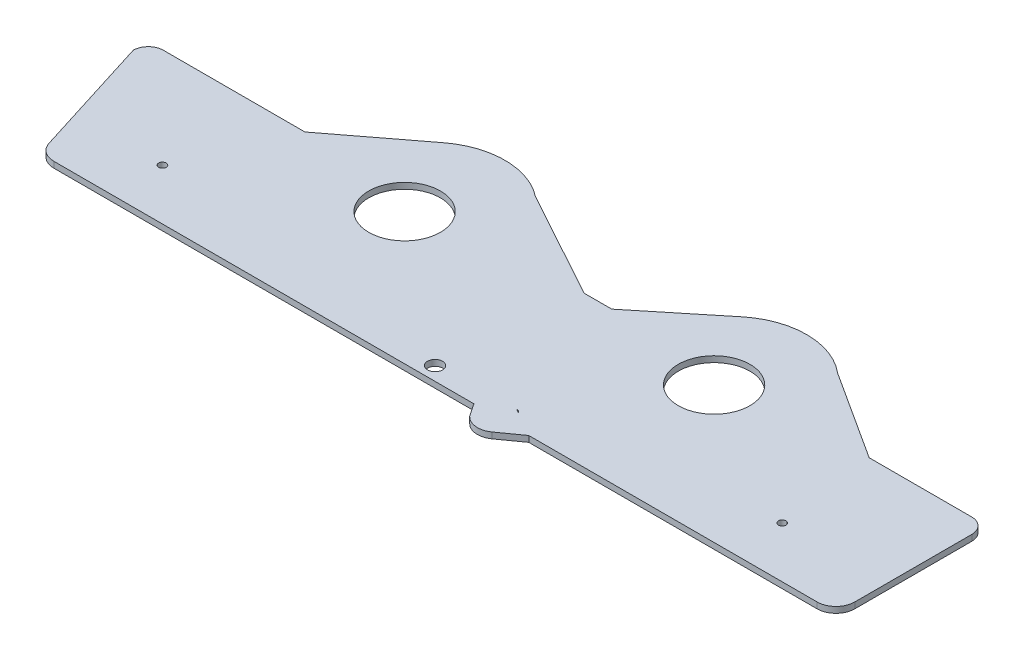
from build123d import *

# Parameters (mm, degrees)
SKETCH1_R                = 4.6
BOSS_EXTRUDE1_DEPTH      = 3.175
SKETCH2_W                = 597.466303312
SKETCH2_H                = 60.972543052
CUT_EXTRUDE1_DEPTH       = 70
FILLET1_R                = 10
FILLET2_R                = 10
SKETCH3_R                = 3.990837639
CUT_EXTRUDE2_DEPTH       = 10
SKETCH4_R                = 2
CUT_EXTRUDE3_DEPTH       = 470.13785887
SKETCH5_R                = 2
CUT_EXTRUDE4_DEPTH       = 10
SKETCH6_R                = 40
BOSS_EXTRUDE2_DEPTH      = 3.175
BOSS_EXTRUDE3_DEPTH      = 3.175
SKETCH9_R                = 40
BOSS_EXTRUDE4_DEPTH      = 3.175
BOSS_EXTRUDE6_DEPTH      = 3.175
SKETCH13_R               = 19
CUT_EXTRUDE5_DEPTH       = 10
SKETCH14_R               = 19
CUT_EXTRUDE6_DEPTH       = 10
BOSS_EXTRUDE7_DEPTH      = 10
BOSS_EXTRUDE7_DEPTH_BACK = 3.175
SKETCH16_W               = 39.380598922
SKETCH16_H               = 33.904845405
CUT_EXTRUDE7_DEPTH       = 10


with BuildPart() as part:
    # Sketch1 → Boss-Extrude1 (new body)
    with BuildSketch(Plane(origin=(0, 0, 0), x_dir=(1, 0, 0), z_dir=(0, 1, 0))):
        with BuildLine():
            ThreePointArc((8, 150), (2.343145751, 147.656854249), (0, 142))
            Line((0, 142), (42, 8))
            ThreePointArc((42, 8), (44.343145751, 2.343145751), (50, 0))
            Line((50, 0), (436.5, 0))
            ThreePointArc((436.5, 0), (442.156854249, 2.343145751), (444.5, 8))
            Line((444.5, 8), (444.5, 142))
            ThreePointArc((444.5, 142), (442.156854249, 147.656854249), (436.5, 150))
            Line((436.5, 150), (172.868406334, 150))
            ThreePointArc((172.868406334, 150), (172.5, 146.64039861), (172.131593666, 150))
            Line((172.131593666, 150), (8, 150))
        make_face()
        with Locations(Location((265.281257274, 74.563866981, 0), (0, 0, 270))):
            Circle(SKETCH1_R, mode=Mode.SUBTRACT)
    extrude(amount=BOSS_EXTRUDE1_DEPTH)

    # Sketch2 → Cut-Extrude1 (cut)
    with BuildSketch(Plane.XY):
        with Locations((220.1785332, 7.544358636)):
            Rectangle(SKETCH2_W, SKETCH2_H)
    extrude(amount=-CUT_EXTRUDE1_DEPTH, mode=Mode.SUBTRACT)

    # Fillet1
    fillet1_edges = [part.edges().sort_by_distance(p)[0] for p in [
        (22.567164179, 1.5875, -70),
    ]]
    fillet(fillet1_edges, radius=FILLET1_R)

    # Fillet2
    fillet2_edges = [part.edges().sort_by_distance(p)[0] for p in [
        (444.5, 1.5875, -70),
    ]]
    fillet(fillet2_edges, radius=FILLET2_R)

    # Sketch3 → Cut-Extrude2 (cut)
    with BuildSketch(Plane(origin=(0, 3.175, 0), x_dir=(1, 0, 0), z_dir=(0, 1, 0))):
        with Locations(Location((224.75, 77.255, 0), (0, 0, 270))):
            Circle(SKETCH3_R)
    extrude(amount=-CUT_EXTRUDE2_DEPTH, mode=Mode.SUBTRACT)

    # Sketch4 → Cut-Extrude3 (cut, through all)
    with BuildSketch(Plane(origin=(0, 3.175, 0), x_dir=(1, 0, 0), z_dir=(0, 1, 0))):
        with Locations(Location((60.5, 97, 0), (0, 0, 270))):
            Circle(SKETCH4_R)
    extrude(amount=-CUT_EXTRUDE3_DEPTH, mode=Mode.SUBTRACT)

    # Sketch5 → Cut-Extrude4 (cut)
    with BuildSketch(Plane(origin=(0, 3.175, 0), x_dir=(1, 0, 0), z_dir=(0, 1, 0))):
        with Locations(Location((389, 97, 0), (0, 0, 270))):
            Circle(SKETCH5_R)
    extrude(amount=-CUT_EXTRUDE4_DEPTH, mode=Mode.SUBTRACT)

    # Sketch6 → Boss-Extrude2 (add)
    with BuildSketch(Plane(origin=(0, 0, 0), x_dir=(1, 0, 0), z_dir=(0, 1, 0))):
        with Locations((149, 150.04039861)):
            Circle(SKETCH6_R)
    extrude(amount=BOSS_EXTRUDE2_DEPTH)

    # Sketch7 → Boss-Extrude3 (add)
    with BuildSketch(Plane(origin=(0, 0, 0), x_dir=(1, 0, 0), z_dir=(0, 1, 0))):
        Polygon((124.164543783, 181.396420591), (82.702881078, 149.750534228), (231.468946681, 149.750534228), (173.835456217, 181.396420591), align=None)
    extrude(amount=BOSS_EXTRUDE3_DEPTH)

    # Sketch9 → Boss-Extrude4 (add)
    with BuildSketch(Plane(origin=(0, 0, 0), x_dir=(1, 0, 0), z_dir=(0, 1, 0))):
        with BuildLine():
            ThreePointArc((269, 150), (272.870833001, 167.166341835), (283.734164599, 181.010281545))
            Line((283.734164599, 181.010281545), (245.673378314, 150))
            Line((245.673378314, 150), (269, 150))
        make_face()
        with Locations((309, 150)):
            Circle(SKETCH9_R)
    extrude(amount=BOSS_EXTRUDE4_DEPTH)

    # Sketch12 → Boss-Extrude6 (add)
    with BuildSketch(Plane(origin=(0, 0, 0), x_dir=(1, 0, 0), z_dir=(0, 1, 0))):
        Polygon((326.166341835, 186.129166999), (382.106475607, 150), (340.398839744, 150), align=None)
    extrude(amount=BOSS_EXTRUDE6_DEPTH)

    # Sketch13 → Cut-Extrude5 (cut)
    with BuildSketch(Plane(origin=(0, 3.175, 0), x_dir=(1, 0, 0), z_dir=(0, 1, 0))):
        with Locations(Location((146, 139.84039861, 0), (0, 0, 270))):
            Circle(SKETCH13_R)
    extrude(amount=-CUT_EXTRUDE5_DEPTH, mode=Mode.SUBTRACT)

    # Sketch14 → Cut-Extrude6 (cut)
    with BuildSketch(Plane(origin=(0, 3.175, 0), x_dir=(1, 0, 0), z_dir=(0, 1, 0))):
        with Locations(Location((307.606475607, 142.298064477, 0), (0, 0, 270))):
            Circle(SKETCH14_R)
    extrude(amount=-CUT_EXTRUDE6_DEPTH, mode=Mode.SUBTRACT)

    # Sketch15 → Boss-Extrude7 (add, two sides: drawn at the far end of the back side and taken through both)
    with BuildSketch(Plane(origin=(0, 3.175, 0), x_dir=(1, 0, 0), z_dir=(0, 1, 0)).offset(-BOSS_EXTRUDE7_DEPTH_BACK)):
        with BuildLine():
            Line((270.323640372, 61.870718801), (281.671389991, 70))
            Line((281.671389991, 70), (265.856685963, 70))
            ThreePointArc((265.856685963, 70), (269.551101507, 72.852601302), (268.849345077, 77.467097842))
            Line((268.849345077, 77.467097842), (266.045546336, 79.099929396))
            ThreePointArc((266.045546336, 79.099929396), (260.730312777, 75.233870106), (264.705828584, 70))
            Line((264.705828584, 70), (252.589726142, 70))
            Line((252.589726142, 70), (257.164027826, 63.204154779))
            ThreePointArc((257.164027826, 63.204154779), (263.491883069, 60.050944756), (270.323640372, 61.870718801))
        make_face()
    extrude(amount=BOSS_EXTRUDE7_DEPTH + BOSS_EXTRUDE7_DEPTH_BACK)

    # Sketch16 → Cut-Extrude7 (cut)
    with BuildSketch(Plane(origin=(0, 13.175, 0), x_dir=(1, 0, 0), z_dir=(0, 1, 0))):
        with Locations((267.135263248, 68.050551455)):
            Rectangle(SKETCH16_W, SKETCH16_H)
    extrude(amount=-CUT_EXTRUDE7_DEPTH, mode=Mode.SUBTRACT)


solid = part.part
